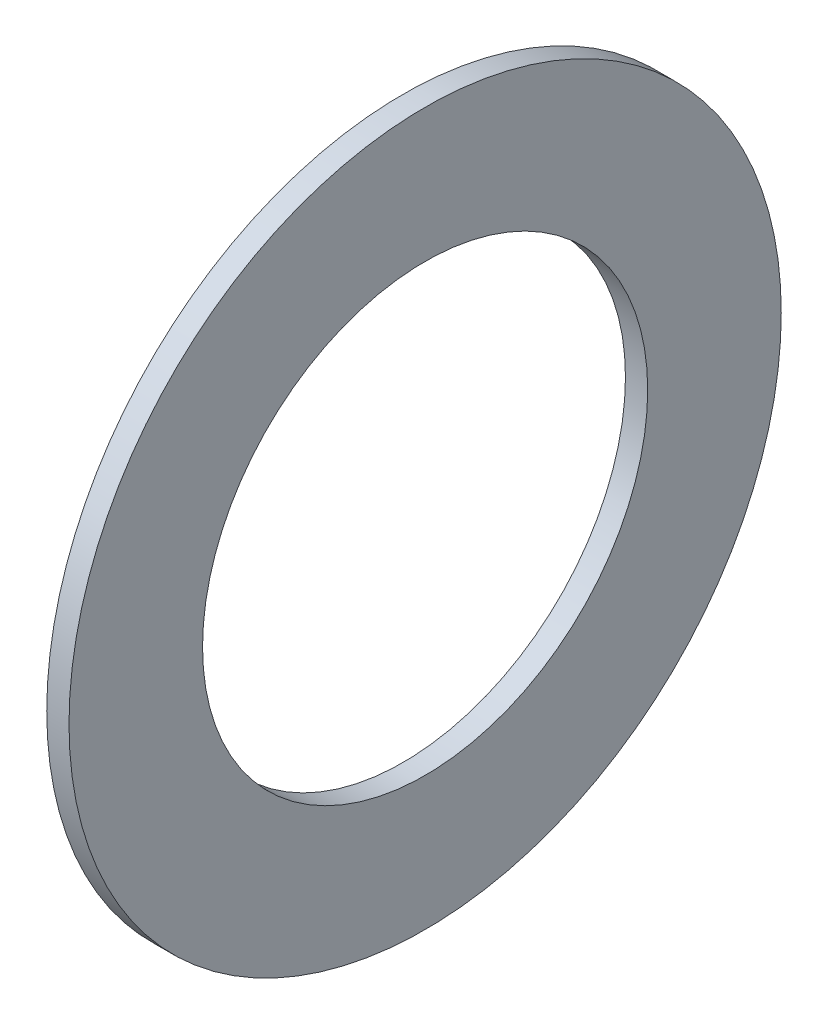
from build123d import *

# Parameters (mm, degrees)
SKETCH_1_R      = 8
SKETCH_1_R_2    = 5
EXTRUDE_1_DEPTH = 0.5


with BuildPart() as part:
    # 草图1 → 凸台-拉伸1 (new body)
    with BuildSketch(Plane(origin=(0, 0, 0), x_dir=(0, 0, -1), z_dir=(1, 0, 0))):
        Circle(SKETCH_1_R)
        Circle(SKETCH_1_R_2, mode=Mode.SUBTRACT)
    extrude(amount=EXTRUDE_1_DEPTH)


solid = part.part
